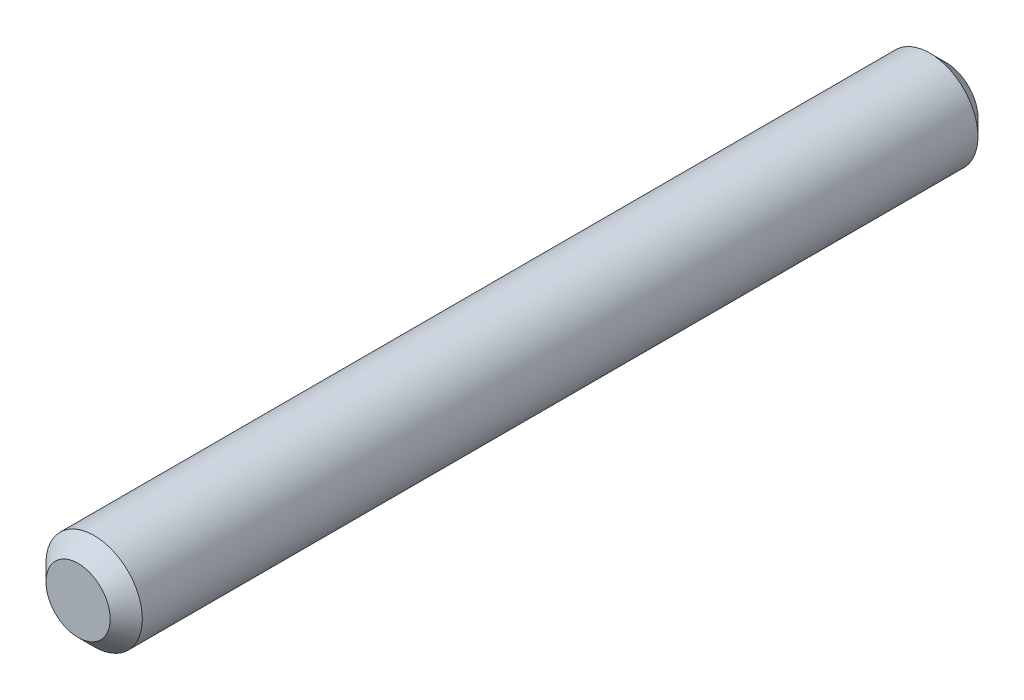
from build123d import *

# Parameters (mm, degrees)
SKETCH1_R           = 3
BOSS_EXTRUDE1_DEPTH = 54
CHAMFER1_SIZE       = 1


with BuildPart() as part:
    # Sketch1 → Boss-Extrude1 (new body)
    with BuildSketch(Plane.XY):
        Circle(SKETCH1_R)
    extrude(amount=BOSS_EXTRUDE1_DEPTH)

    # Chamfer1
    chamfer1_edges = [part.edges().sort_by_distance(p)[0] for p in [
        (-3, 0, 0),
        (-3, 0, 54),
    ]]
    chamfer(chamfer1_edges, length=CHAMFER1_SIZE)


solid = part.part
